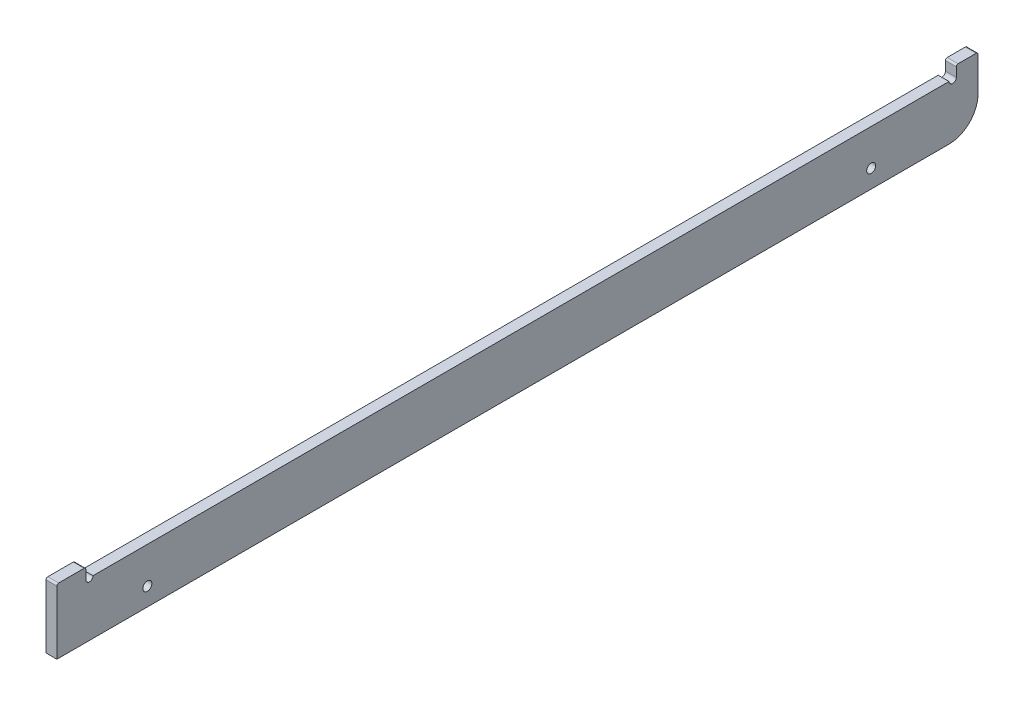
from build123d import *

# Parameters (mm, degrees)
SKETCH_1_W          = 254.5
SKETCH_1_H          = 15
EXTRUDE_1_DEPTH     = 3
SKETCH_2_W          = 8
SKETCH_2_H          = 3
SKETCH_2_W_2        = 6
EXTRUDE_2_DEPTH     = 3
SKETCH_3_R          = 1
CUT_EXTRUDE_1_DEPTH = 3
FILLET_1_R          = 0.5
SKETCH_4_R          = 1.25
CUT_EXTRUDE_2_DEPTH = 10
FILLET_2_R          = 8


with BuildPart() as part:
    # 스케치1 → 보스-돌출1 (new body)
    with BuildSketch(Plane(origin=(0, 0, 0), x_dir=(0, 0, -1), z_dir=(1, 0, 0))):
        with Locations((127.25, 7.5)):
            Rectangle(SKETCH_1_W, SKETCH_1_H)
    extrude(amount=EXTRUDE_1_DEPTH)

    # 스케치2 → 보스-돌출2 (add)
    with BuildSketch(Plane(origin=(3, 0, 0), x_dir=(0, 0, -1), z_dir=(1, 0, 0))):
        with Locations((4, 16.5)):
            Rectangle(SKETCH_2_W, SKETCH_2_H)
        with Locations((251.5, 16.5)):
            Rectangle(SKETCH_2_W_2, SKETCH_2_H)
    extrude(amount=-EXTRUDE_2_DEPTH)

    # 스케치3 → 컷-돌출1 (cut)
    with BuildSketch(Plane(origin=(3, 0, 0), x_dir=(0, 0, -1), z_dir=(1, 0, 0))):
        with Locations((9, 15)):
            Circle(SKETCH_3_R)
        with Locations((247.5, 15)):
            Circle(SKETCH_3_R)
    extrude(amount=-CUT_EXTRUDE_1_DEPTH, mode=Mode.SUBTRACT)

    # 필렛1
    fillet_1_edges = [part.edges().sort_by_distance(p)[0] for p in [
        (1.5, 18, 0),
        (1.5, 18, -8),
        (1.5, 18, -254.5),
        (1.5, 18, -248.5),
    ]]
    fillet(fillet_1_edges, radius=FILLET_1_R)

    # 스케치4 → 컷-돌출2 (cut)
    with BuildSketch(Plane(origin=(3, 0, 0), x_dir=(0, 0, -1), z_dir=(1, 0, 0))):
        with Locations((225, 5)):
            Circle(SKETCH_4_R)
        with Locations((25, 5)):
            Circle(SKETCH_4_R)
    extrude(amount=-CUT_EXTRUDE_2_DEPTH, mode=Mode.SUBTRACT)

    # 필렛2
    fillet_2_edges = [part.edges().sort_by_distance(p)[0] for p in [
        (1.5, 0, -254.5),
    ]]
    fillet(fillet_2_edges, radius=FILLET_2_R)


solid = part.part
